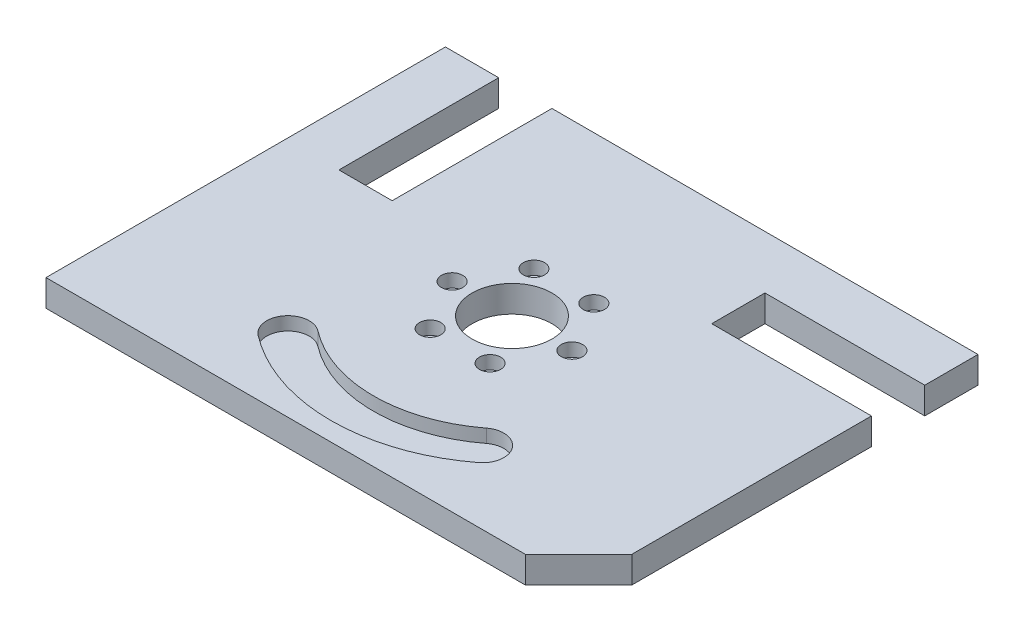
from build123d import *

# Parameters (mm, degrees)
BOSS_EXTRUDE1_DEPTH = 10
SKETCH2_R           = 15
CUT_EXTRUDE1_DEPTH  = 126.39936204
SKETCH2_3_R         = 15
SKETCH2_3_R_2       = 4
CUT_EXTRUDE2_DEPTH  = 5
CHAMFER1_SIZE       = 20


with BuildPart() as part:
    # Sketch1 → Boss-Extrude1 (new body)
    with BuildSketch(Plane(origin=(0, 0, 0), x_dir=(1, 0, 0), z_dir=(0, 1, 0))):
        Polygon((-80, 75), (-80, 15), (-60, 15), (-60, 75), (100, 75), (100, 55), (40, 55), (40, 35), (100, 35), (100, -75), (-100, -75), (-100, 75), align=None)
    extrude(amount=BOSS_EXTRUDE1_DEPTH)

    # Sketch2 → Cut-Extrude1 (cut, through all)
    with BuildSketch(Plane(origin=(0, 10, 0), x_dir=(1, 0, 0), z_dir=(0, 1, 0))):
        Circle(SKETCH2_R)
    extrude(amount=-CUT_EXTRUDE1_DEPTH, mode=Mode.SUBTRACT)

    # Sketch2<3> → Cut-Extrude2 (cut)
    with BuildSketch(Plane(origin=(0, 10, 0), x_dir=(1, 0, 0), z_dir=(0, 1, 0))):
        Circle(SKETCH2_3_R)
        with Locations((22.5, 0)):
            Circle(SKETCH2_3_R_2)
        with Locations((11.25, -19.485571585)):
            Circle(SKETCH2_3_R_2)
        with Locations((-11.25, -19.485571585)):
            Circle(SKETCH2_3_R_2)
        with Locations((-22.5, 0)):
            Circle(SKETCH2_3_R_2)
        with Locations((-11.25, 19.485571585)):
            Circle(SKETCH2_3_R_2)
        with Locations((11.25, 19.485571585)):
            Circle(SKETCH2_3_R_2)
        with BuildLine():
            ThreePointArc((-41.390750416, -53.951883934), (0, -68), (41.390750416, -53.951883934))
            ThreePointArc((41.390750416, -53.951883934), (42.86853083, -42.735103422), (31.651750318, -41.257323008))
            ThreePointArc((31.651750318, -41.257323008), (0, -52), (-31.651750318, -41.257323008))
            ThreePointArc((-31.651750318, -41.257323008), (-42.86853083, -42.735103422), (-41.390750416, -53.951883934))
        make_face()
    extrude(amount=-CUT_EXTRUDE2_DEPTH, mode=Mode.SUBTRACT)

    # Chamfer1
    chamfer1_edges = [part.edges().sort_by_distance(p)[0] for p in [
        (100, 5, 75),
    ]]
    chamfer(chamfer1_edges, length=CHAMFER1_SIZE)


solid = part.part
